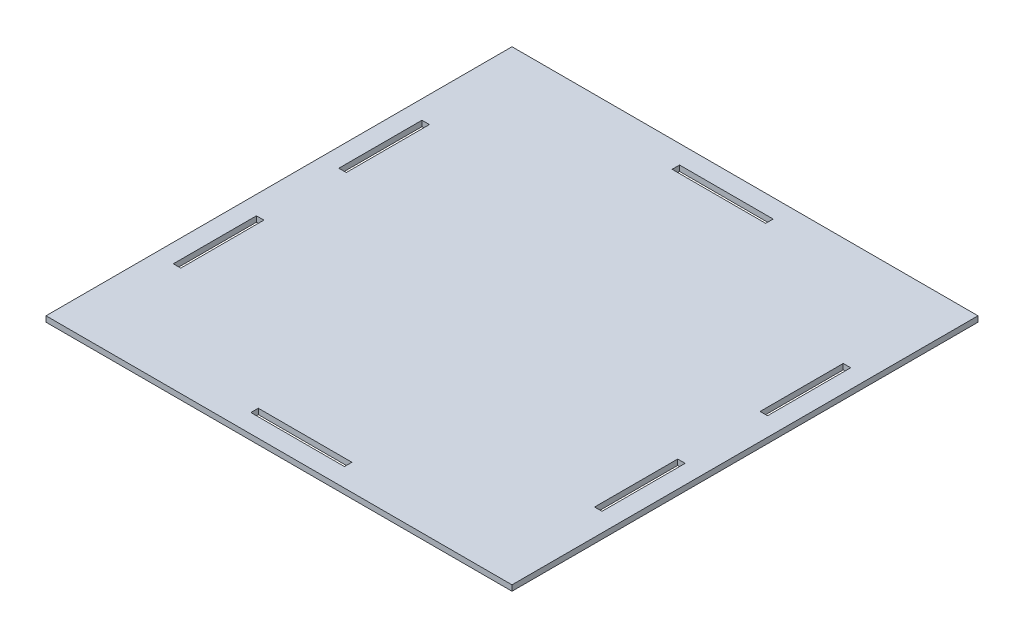
from build123d import *

# Parameters (mm, degrees)
SKETCH1_W           = 250
SKETCH1_H           = 250
SKETCH1_W_2         = 50.2
SKETCH1_H_2         = 4
SKETCH1_W_3         = 4
SKETCH1_H_3         = 44.6
BOSS_EXTRUDE2_DEPTH = 3


with BuildPart() as part:
    # Sketch1 → Boss-Extrude2 (new body)
    with BuildSketch(Plane(origin=(0, 0, 0), x_dir=(1, 0, 0), z_dir=(0, 1, 0))):
        Rectangle(SKETCH1_W, SKETCH1_H)
        with Locations((0, 113)):
            Rectangle(SKETCH1_W_2, SKETCH1_H_2, mode=Mode.SUBTRACT)
        with Locations((0, -113)):
            Rectangle(SKETCH1_W_2, SKETCH1_H_2, mode=Mode.SUBTRACT)
        with Locations((113, -44.4)):
            Rectangle(SKETCH1_W_3, SKETCH1_H_3, mode=Mode.SUBTRACT)
        with Locations((-113, -44.4)):
            Rectangle(SKETCH1_W_3, SKETCH1_H_3, mode=Mode.SUBTRACT)
        with Locations((113, 44.4)):
            Rectangle(SKETCH1_W_3, SKETCH1_H_3, mode=Mode.SUBTRACT)
        with Locations((-113, 44.4)):
            Rectangle(SKETCH1_W_3, SKETCH1_H_3, mode=Mode.SUBTRACT)
    extrude(amount=BOSS_EXTRUDE2_DEPTH)


solid = part.part
